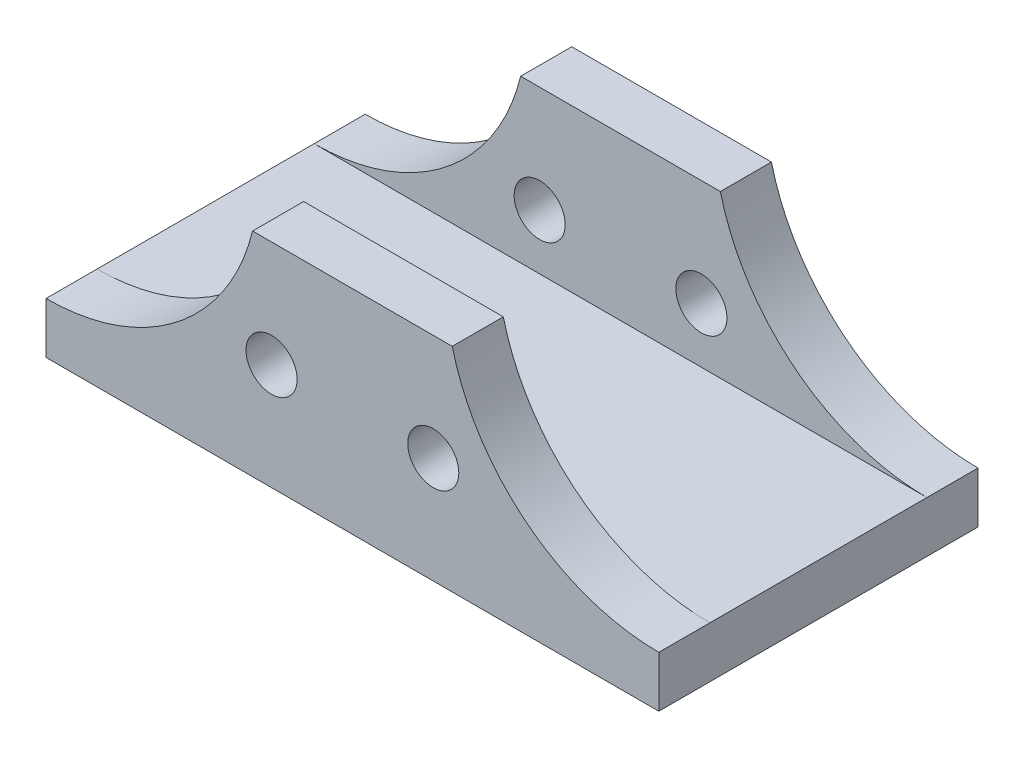
from build123d import *

# Parameters (mm, degrees)
SKETCH1_W           = 144
SKETCH1_H           = 50
BOSS_EXTRUDE1_DEPTH = 37.5
CUT_EXTRUDE1_DEPTH  = 75
SKETCH3_W           = 144
SKETCH3_H           = 51
CUT_EXTRUDE2_DEPTH  = 38
HOLE1_D             = 12


with BuildPart() as part:
    # Sketch1 → Boss-Extrude1 (new, symmetric)
    with BuildSketch(Plane.XY):
        Rectangle(SKETCH1_W, SKETCH1_H)
    extrude(amount=BOSS_EXTRUDE1_DEPTH, both=True)

    # Sketch2 → Cut-Extrude1 (cut)
    with BuildSketch(Plane.XY.offset(37.5)):
        with BuildLine():
            Line((-23.461355602, 25), (-72, 25))
            Line((-72, 25), (-72, -13))
            ThreePointArc((-72, -13), (-41.177929985, -2.37003937), (-23.461355602, 25))
        make_face()
        with BuildLine():
            Line((72, 25), (72, -13))
            ThreePointArc((72, -13), (41.177929985, -2.37003937), (23.461355602, 25))
            Line((23.461355602, 25), (72, 25))
        make_face()
    extrude(amount=-CUT_EXTRUDE1_DEPTH, mode=Mode.SUBTRACT)

    # Sketch3 → Cut-Extrude2 (cut)
    with BuildSketch(Plane(origin=(0, 25, 0), x_dir=(1, 0, 0), z_dir=(0, 1, 0))):
        Rectangle(SKETCH3_W, SKETCH3_H)
    extrude(amount=-CUT_EXTRUDE2_DEPTH, mode=Mode.SUBTRACT)

    # Hole1 (through all)
    with Locations(Plane.XY.offset(37.5)):
        with Locations((19, 0), (-19, 0)):
            Hole(HOLE1_D / 2)


solid = part.part
